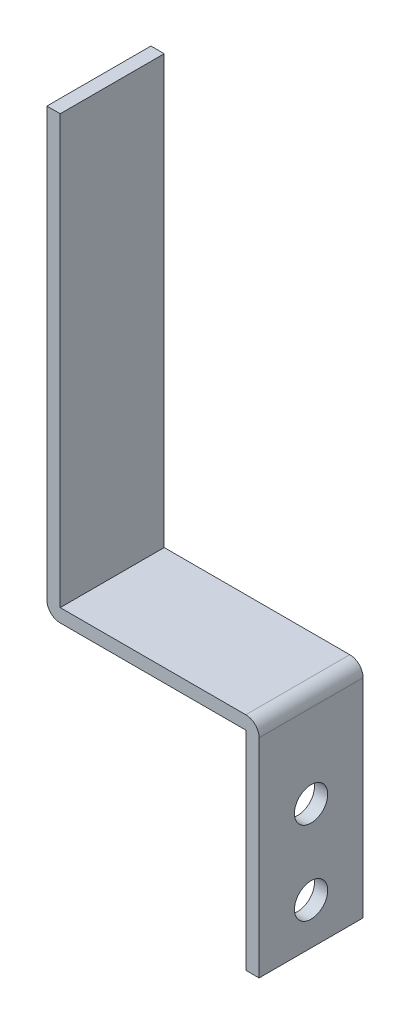
from build123d import *

# Parameters (mm, degrees)
EXTRUDE_1_DEPTH          = 25
CUT_EXTRUDE_5_DEPTH      = 167.018071306
CUT_EXTRUDE_5_DEPTH_BACK = 167.018071306
SKETCH_7_R               = 4


with BuildPart() as part:
    # ｽｹｯﾁ1 → ﾎﾞｽ - 押し出し1 (new body)
    with BuildSketch(Plane.XY):
        with BuildLine():
            Line((0, 156), (0, 53.2))
            ThreePointArc((0, 53.2), (0.9372583, 50.9372583), (3.2, 50))
            Line((3.2, 50), (47.8, 50))
            Line((47.8, 50), (47.8, 0))
            Line((47.8, 0), (51, 0))
            Line((51, 0), (51, 50))
            ThreePointArc((51, 50), (50.0627417, 52.2627417), (47.8, 53.2))
            Line((47.8, 53.2), (3.2, 53.2))
            Line((3.2, 53.2), (3.2, 156))
            Line((3.2, 156), (0, 156))
        make_face()
    extrude(amount=EXTRUDE_1_DEPTH)

    # ｽｹｯﾁ7 → ｶｯﾄ - 押し出し5 (cut, two sides: drawn at the far end of the back side and taken through both)
    with BuildSketch(Plane(origin=(0, 0, 0), x_dir=(0, 0, -1), z_dir=(1, 0, 0)).offset(-CUT_EXTRUDE_5_DEPTH_BACK)):
        with Locations((-12.5, 10)):
            Circle(SKETCH_7_R)
        with Locations((-12.5, 30)):
            Circle(SKETCH_7_R)
    extrude(amount=CUT_EXTRUDE_5_DEPTH + CUT_EXTRUDE_5_DEPTH_BACK, mode=Mode.SUBTRACT)


solid = part.part
